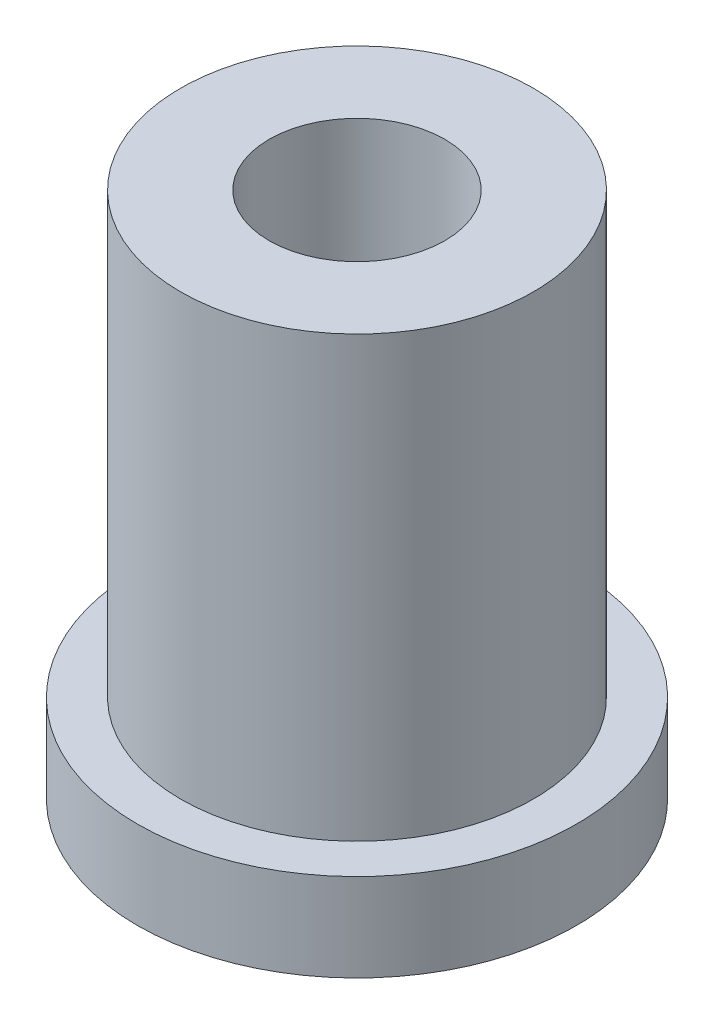
from build123d import *

# Parameters (mm, degrees)
SKETCH2_R           = 3.1877
SKETCH2_R_2         = 1.5875
BOSS_EXTRUDE1_DEPTH = 9.525
SKETCH3_R           = 3.96875
SKETCH3_R_2         = 3.1877
BOSS_EXTRUDE2_DEPTH = 1.5875


with BuildPart() as part:
    # Sketch2 → Boss-Extrude1 (new body)
    with BuildSketch(Plane(origin=(0, 0, 0), x_dir=(1, 0, 0), z_dir=(0, 1, 0))):
        with Locations(Location((0, 0, 0), (0, 0, 90))):
            Circle(SKETCH2_R)
        with Locations(Location((0, 0, 0), (0, 0, 90))):
            Circle(SKETCH2_R_2, mode=Mode.SUBTRACT)
    extrude(amount=BOSS_EXTRUDE1_DEPTH)

    # Sketch3 → Boss-Extrude2 (add)
    with BuildSketch(Plane(origin=(0, 0, 0), x_dir=(1, 0, 0), z_dir=(0, 1, 0))):
        with Locations(Location((0, 0, 0), (0, 0, 270))):
            Circle(SKETCH3_R)
        with Locations(Location((0, 0, 0), (0, 0, 90))):
            Circle(SKETCH3_R_2, mode=Mode.SUBTRACT)
    extrude(amount=BOSS_EXTRUDE2_DEPTH)


solid = part.part
